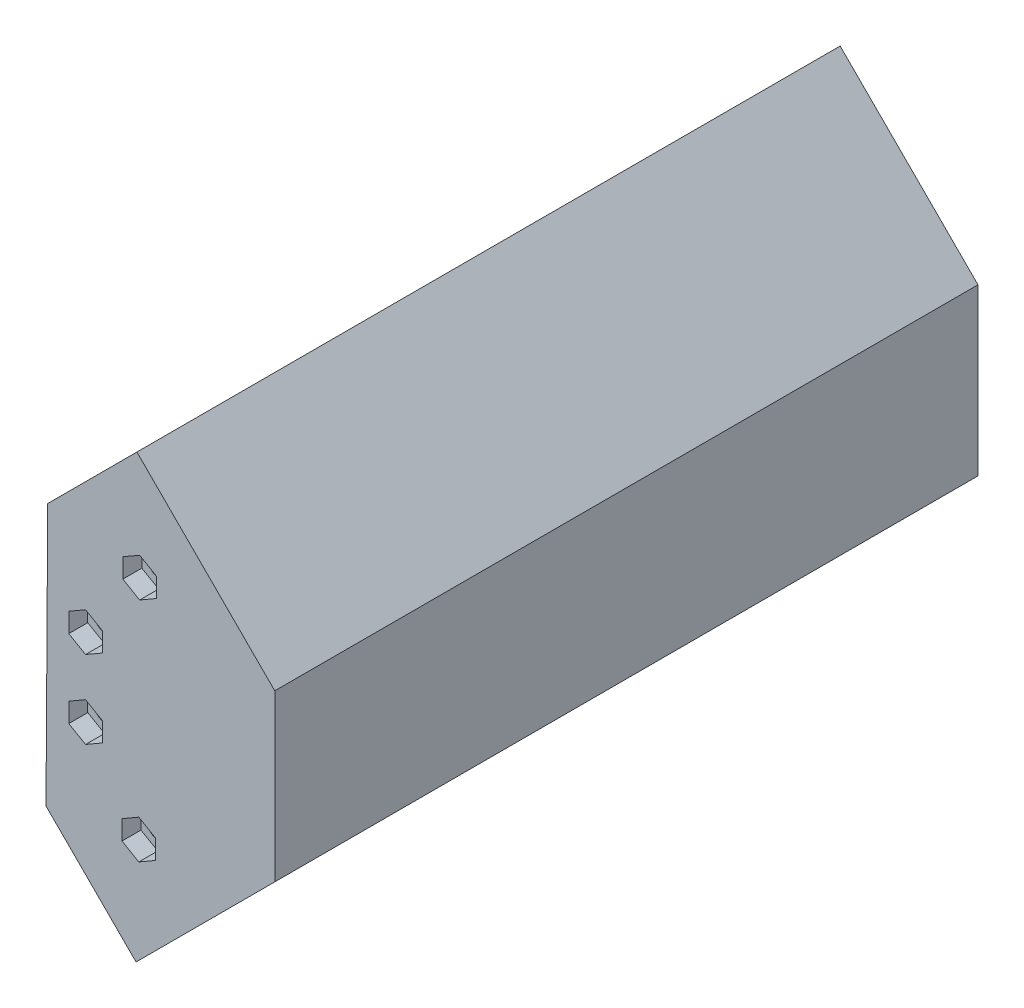
from build123d import *

# Parameters (mm, degrees)
SKETCH1_R                      = 2
BOSS_EXTRUDE1_DEPTH            = 6
CUT_EXTRUDE1_DEPTH             = 3.9
BOSS_EXTRUDE2_DEPTH            = 138.475201729
BOSS_EXTRUDE3_DEPTH            = 8
CUT_EXTRUDE2_REACH             = 160.595
SKETCH5_R                      = 2
CUT_EXTRUDE2_DIRECTION_2_DEPTH = 159.594869272
CUT_EXTRUDE3_DEPTH             = 3.9


with BuildPart() as part:
    # Sketch1 → Boss-Extrude1 (new body)
    with BuildSketch(Plane.XY):
        Polygon((0, 17), (0, -17), (-10, -27), (-28.499995142, -45.499995142), (-46.999990284, -27), (-46.646446609, 27), (-28.323223305, 45.323223305), (-10, 27), align=None)
        with Locations((-10, -8)):
            Circle(SKETCH1_R, mode=Mode.SUBTRACT)
        with Locations((-10, 8)):
            Circle(SKETCH1_R, mode=Mode.SUBTRACT)
    extrude(amount=BOSS_EXTRUDE1_DEPTH)

    # Sketch2 → Cut-Extrude1 (cut)
    with BuildSketch(Plane.XY.offset(6)):
        Polygon((-10, 11.983716857), (-13.45, 9.991858429), (-13.45, 6.008141571), (-10, 4.016283143), (-6.55, 6.008141571), (-6.55, 9.991858429), align=None)
        Polygon((-10, -4.016283143), (-13.45, -6.008141571), (-13.45, -9.991858429), (-10, -11.983716857), (-6.55, -9.991858429), (-6.55, -6.008141571), align=None)
    extrude(amount=-CUT_EXTRUDE1_DEPTH, mode=Mode.SUBTRACT)

    # Sketch3 → Boss-Extrude2 (add)
    with BuildSketch(Plane.XY.offset(6)):
        Polygon((-28.499995142, -39.136034112), (-4.5, -15.136038969), (-4.5, 15.136038969), (-28.323223305, 38.959262274), (-31.50520382, 42.141242789), (-28.323223305, 45.323223305), (0, 17), (0, -17), (-28.499995142, -45.499995142), (-31.681975658, -42.318014627), align=None)
    extrude(amount=BOSS_EXTRUDE2_DEPTH)

    # Sketch4 → Boss-Extrude3 (add)
    with BuildSketch(Plane.XY.offset(144.475201729)):
        Polygon((0, 17), (0, -17), (-28.499995142, -45.499995142), (-46.999990284, -27), (-46.646446609, 27), (-28.323223305, 45.323223305), align=None)
    extrude(amount=-BOSS_EXTRUDE3_DEPTH)

    # Sketch5 → Cut-Extrude2 (cut, up to next)
    with BuildSketch(Plane.XY.offset(144.475201729), mode=Mode.PRIVATE) as cut_extrude2_sk1:
        with Locations(Location((-27.938888553, -23.433684733, 0), (0, 0, 180))):
            Circle(SKETCH5_R)
    cut_extrude2_tool1 = extrude(cut_extrude2_sk1.sketch, amount=-CUT_EXTRUDE2_REACH, mode=Mode.PRIVATE) & part.part
    # Sketch5 → Cut-Extrude2 (cut, up to next)
    with BuildSketch(Plane.XY.offset(144.475201729), mode=Mode.PRIVATE) as cut_extrude2_sk2:
        with Locations(Location((-27.762116716, 23.256912896, 0), (0, 0, 180))):
            Circle(SKETCH5_R)
    cut_extrude2_tool2 = extrude(cut_extrude2_sk2.sketch, amount=-CUT_EXTRUDE2_REACH, mode=Mode.PRIVATE) & part.part
    # Sketch5 → Cut-Extrude2 (cut, up to next)
    with BuildSketch(Plane.XY.offset(144.475201729), mode=Mode.PRIVATE) as cut_extrude2_sk3:
        with Locations(Location((-38.875423831, -8, 0), (0, 0, 180))):
            Circle(SKETCH5_R)
    cut_extrude2_tool3 = extrude(cut_extrude2_sk3.sketch, amount=-CUT_EXTRUDE2_REACH, mode=Mode.PRIVATE) & part.part
    # Sketch5 → Cut-Extrude2 (cut, up to next)
    with BuildSketch(Plane.XY.offset(144.475201729), mode=Mode.PRIVATE) as cut_extrude2_sk4:
        with Locations(Location((-38.875423831, 8, 0), (0, 0, 180))):
            Circle(SKETCH5_R)
    cut_extrude2_tool4 = extrude(cut_extrude2_sk4.sketch, amount=-CUT_EXTRUDE2_REACH, mode=Mode.PRIVATE) & part.part
    add(cut_extrude2_tool1.solids().sort_by_distance((-27.938889, -23.433685, 144.475202))[0], mode=Mode.SUBTRACT)
    add(cut_extrude2_tool2.solids().sort_by_distance((-27.762117, 23.256913, 144.475202))[0], mode=Mode.SUBTRACT)
    add(cut_extrude2_tool3.solids().sort_by_distance((-38.875424, -8, 144.475202))[0], mode=Mode.SUBTRACT)
    add(cut_extrude2_tool4.solids().sort_by_distance((-38.875424, 8, 144.475202))[0], mode=Mode.SUBTRACT)

    # Sketch5 → Cut-Extrude2 direction 2 (cut)
    with BuildSketch(Plane.XY.offset(144.475201729)):
        with Locations(Location((-27.938888553, -23.433684733, 0), (0, 0, 180))):
            Circle(SKETCH5_R)
        with Locations(Location((-27.762116716, 23.256912896, 0), (0, 0, 180))):
            Circle(SKETCH5_R)
        with Locations(Location((-38.875423831, -8, 0), (0, 0, 180))):
            Circle(SKETCH5_R)
        with Locations(Location((-38.875423831, 8, 0), (0, 0, 180))):
            Circle(SKETCH5_R)
    extrude(amount=CUT_EXTRUDE2_DIRECTION_2_DEPTH, mode=Mode.SUBTRACT)

    # Sketch6 → Cut-Extrude3 (cut)
    with BuildSketch(Plane.XY.offset(144.475201729)):
        Polygon((-27.762116716, 27.240629753), (-31.212116716, 25.248771324), (-31.212116716, 21.265054467), (-27.762116716, 19.273196038), (-24.312116716, 21.265054467), (-24.312116716, 25.248771324), align=None)
        Polygon((-38.875423831, 11.983716857), (-42.325423831, 9.991858429), (-42.325423831, 6.008141571), (-38.875423831, 4.016283143), (-35.425423831, 6.008141571), (-35.425423831, 9.991858429), align=None)
        Polygon((-38.875423831, -4.016283143), (-42.325423831, -6.008141571), (-42.325423831, -9.991858429), (-38.875423831, -11.983716857), (-35.425423831, -9.991858429), (-35.425423831, -6.008141571), align=None)
        Polygon((-27.938888553, -19.449967876), (-31.388888553, -21.441826304), (-31.388888553, -25.425543162), (-27.938888553, -27.417401591), (-24.488888553, -25.425543162), (-24.488888553, -21.441826304), align=None)
    extrude(amount=-CUT_EXTRUDE3_DEPTH, mode=Mode.SUBTRACT)


solid = part.part
